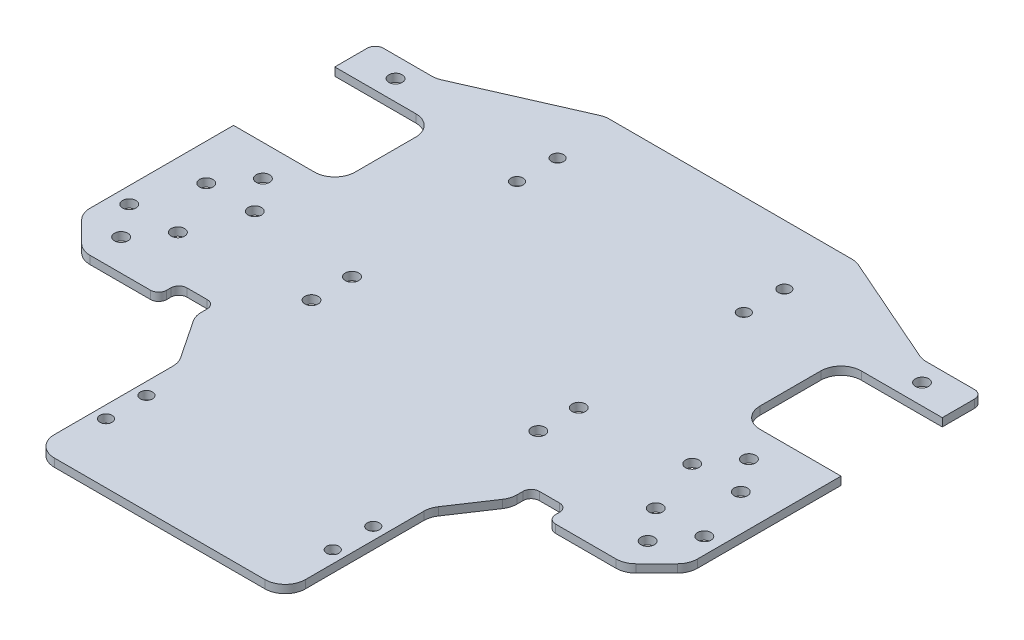
from build123d import *

# Parameters (mm, degrees)
SKETCH_1_W          = 150
SKETCH_1_H          = 141
EXTRUDE_1_DEPTH     = 2
CUT_EXTRUDE_1_REACH = 104.953
SKETCH_2_R          = 1.65
CUT_EXTRUDE_5_REACH = 104.953
SKETCH_9_W          = 44
SKETCH_9_H          = 47.75
CUT_EXTRUDE_2_REACH = 104.953
SKETCH_4_W          = 9
SKETCH_4_H          = 5
CUT_EXTRUDE_6_REACH = 104.953
CHAMFER_1_SIZE      = 8
CUT_EXTRUDE_3_REACH = 104.953
SKETCH_5_R          = 1.65
EXTRUDE_4_DEPTH     = 2
CUT_EXTRUDE_4_REACH = 104.953
SKETCH_8_R          = 1.5
CUT_EXTRUDE_7_REACH = 104.953
SKETCH_11_W         = 25
SKETCH_11_H         = 25
FILLET_5_R          = 5
FILLET_6_R          = 2
CUT_EXTRUDE_8_REACH = 104.953
SKETCH_12_R         = 1.65
FILLET_7_R          = 2


with BuildPart() as part:
    # 草图1 → 凸台-拉伸1 (new body)
    with BuildSketch(Plane(origin=(0, 0, 0), x_dir=(1, 0, 0), z_dir=(0, 1, 0))):
        Rectangle(SKETCH_1_W, SKETCH_1_H)
    extrude(amount=EXTRUDE_1_DEPTH)

    # 草图2 → 切除-拉伸1 (cut, up to next)
    with BuildSketch(Plane(origin=(0, 2, 0), x_dir=(1, 0, 0), z_dir=(0, 1, 0)), mode=Mode.PRIVATE) as cut_extrude_1_sk1:
        with Locations(Location((-60, 15, 0), (0, 0, 270))):
            Circle(SKETCH_2_R)
    cut_extrude_1_tool1 = extrude(cut_extrude_1_sk1.sketch, amount=-CUT_EXTRUDE_1_REACH, mode=Mode.PRIVATE) & part.part
    # 草图2 → 切除-拉伸1 (cut, up to next)
    with BuildSketch(Plane(origin=(0, 2, 0), x_dir=(1, 0, 0), z_dir=(0, 1, 0)), mode=Mode.PRIVATE) as cut_extrude_1_sk2:
        with Locations(Location((-66, 7, 0), (0, 0, 270))):
            Circle(SKETCH_2_R)
    cut_extrude_1_tool2 = extrude(cut_extrude_1_sk2.sketch, amount=-CUT_EXTRUDE_1_REACH, mode=Mode.PRIVATE) & part.part
    # 草图2 → 切除-拉伸1 (cut, up to next)
    with BuildSketch(Plane(origin=(0, 2, 0), x_dir=(1, 0, 0), z_dir=(0, 1, 0)), mode=Mode.PRIVATE) as cut_extrude_1_sk3:
        with Locations(Location((-54, 7, 0), (0, 0, 270))):
            Circle(SKETCH_2_R)
    cut_extrude_1_tool3 = extrude(cut_extrude_1_sk3.sketch, amount=-CUT_EXTRUDE_1_REACH, mode=Mode.PRIVATE) & part.part
    # 草图2 → 切除-拉伸1 (cut, up to next)
    with BuildSketch(Plane(origin=(0, 2, 0), x_dir=(1, 0, 0), z_dir=(0, 1, 0)), mode=Mode.PRIVATE) as cut_extrude_1_sk4:
        with Locations(Location((-71, -7, 0), (0, 0, 270))):
            Circle(SKETCH_2_R)
    cut_extrude_1_tool4 = extrude(cut_extrude_1_sk4.sketch, amount=-CUT_EXTRUDE_1_REACH, mode=Mode.PRIVATE) & part.part
    # 草图2 → 切除-拉伸1 (cut, up to next)
    with BuildSketch(Plane(origin=(0, 2, 0), x_dir=(1, 0, 0), z_dir=(0, 1, 0)), mode=Mode.PRIVATE) as cut_extrude_1_sk5:
        with Locations(Location((-59, -7, 0), (0, 0, 270))):
            Circle(SKETCH_2_R)
    cut_extrude_1_tool5 = extrude(cut_extrude_1_sk5.sketch, amount=-CUT_EXTRUDE_1_REACH, mode=Mode.PRIVATE) & part.part
    # 草图2 → 切除-拉伸1 (cut, up to next)
    with BuildSketch(Plane(origin=(0, 2, 0), x_dir=(1, 0, 0), z_dir=(0, 1, 0)), mode=Mode.PRIVATE) as cut_extrude_1_sk6:
        with Locations(Location((-65, -15, 0), (0, 0, 270))):
            Circle(SKETCH_2_R)
    cut_extrude_1_tool6 = extrude(cut_extrude_1_sk6.sketch, amount=-CUT_EXTRUDE_1_REACH, mode=Mode.PRIVATE) & part.part
    cut_extrude_1_1 = cut_extrude_1_tool1.solids().sort_by_distance((-60, 2, -15))[0]
    add(cut_extrude_1_1, mode=Mode.SUBTRACT)
    cut_extrude_1_2 = cut_extrude_1_tool2.solids().sort_by_distance((-66, 2, -7))[0]
    add(cut_extrude_1_2, mode=Mode.SUBTRACT)
    cut_extrude_1_3 = cut_extrude_1_tool3.solids().sort_by_distance((-54, 2, -7))[0]
    add(cut_extrude_1_3, mode=Mode.SUBTRACT)
    cut_extrude_1_4 = cut_extrude_1_tool4.solids().sort_by_distance((-71, 2, 7))[0]
    add(cut_extrude_1_4, mode=Mode.SUBTRACT)
    cut_extrude_1_5 = cut_extrude_1_tool5.solids().sort_by_distance((-59, 2, 7))[0]
    add(cut_extrude_1_5, mode=Mode.SUBTRACT)
    cut_extrude_1_6 = cut_extrude_1_tool6.solids().sort_by_distance((-65, 2, 15))[0]
    add(cut_extrude_1_6, mode=Mode.SUBTRACT)
    cut_extrude_1 = cut_extrude_1_1 + cut_extrude_1_2 + cut_extrude_1_3 + cut_extrude_1_4 + cut_extrude_1_5 + cut_extrude_1_6  # 切除-拉伸1 as one shape, for the pattern or mirror that repeats it

    # 草图9 → 切除-拉伸5 (cut, up to next)
    with BuildSketch(Plane(origin=(0, 2, 0), x_dir=(1, 0, 0), z_dir=(0, 1, 0)), mode=Mode.PRIVATE) as cut_extrude_5_sk1:
        with Locations((-53, -46.625)):
            Rectangle(SKETCH_9_W, SKETCH_9_H)
    cut_extrude_5_tool1 = extrude(cut_extrude_5_sk1.sketch, amount=-CUT_EXTRUDE_5_REACH, mode=Mode.PRIVATE) & part.part
    # 草图9 → 切除-拉伸5 (cut, up to next)
    with BuildSketch(Plane(origin=(0, 2, 0), x_dir=(1, 0, 0), z_dir=(0, 1, 0)), mode=Mode.PRIVATE) as cut_extrude_5_sk2:
        with Locations((53, -46.625)):
            Rectangle(SKETCH_9_W, SKETCH_9_H)
    cut_extrude_5_tool2 = extrude(cut_extrude_5_sk2.sketch, amount=-CUT_EXTRUDE_5_REACH, mode=Mode.PRIVATE) & part.part
    add(cut_extrude_5_tool1.solids().sort_by_distance((-53, 2, 46.625))[0], mode=Mode.SUBTRACT)
    add(cut_extrude_5_tool2.solids().sort_by_distance((53, 2, 46.625))[0], mode=Mode.SUBTRACT)

    # 草图4 → 切除-拉伸2 (cut, up to next)
    with BuildSketch(Plane(origin=(0, 2, 0), x_dir=(1, 0, 0), z_dir=(0, 1, 0)), mode=Mode.PRIVATE) as cut_extrude_2_sk1:
        with Locations((-43.5, -20.25)):
            Rectangle(SKETCH_4_W, SKETCH_4_H)
    cut_extrude_2_tool1 = extrude(cut_extrude_2_sk1.sketch, amount=-CUT_EXTRUDE_2_REACH, mode=Mode.PRIVATE) & part.part
    cut_extrude_2 = cut_extrude_2_tool1.solids().sort_by_distance((-43.5, 2, 20.25))[0]
    add(cut_extrude_2, mode=Mode.SUBTRACT)

    # 草图10 → 切除-拉伸6 (cut, up to next)
    with BuildSketch(Plane(origin=(0, 2, 0), x_dir=(1, 0, 0), z_dir=(0, 1, 0)), mode=Mode.PRIVATE) as cut_extrude_6_sk1:
        Polygon((-75, 70.5), (-31, 70.5), (-60, 57.75), (-75, 57.75), align=None)
    cut_extrude_6_tool1 = extrude(cut_extrude_6_sk1.sketch, amount=-CUT_EXTRUDE_6_REACH, mode=Mode.PRIVATE) & part.part
    cut_extrude_6 = cut_extrude_6_tool1.solids().sort_by_distance((-59.062147, 2, -65.169492))[0]
    add(cut_extrude_6, mode=Mode.SUBTRACT)

    # 镜向1: 切除-拉伸1, 切除-拉伸2, 切除-拉伸6 across plane
    add(cut_extrude_1.mirror(Plane(origin=(0, 0, 0), x_dir=(0, 0, 1), z_dir=(1, 0, 0))), mode=Mode.SUBTRACT)
    add(cut_extrude_2.mirror(Plane(origin=(0, 0, 0), x_dir=(0, 0, 1), z_dir=(1, 0, 0))), mode=Mode.SUBTRACT)
    add(cut_extrude_6.mirror(Plane(origin=(0, 0, 0), x_dir=(0, 0, 1), z_dir=(1, 0, 0))), mode=Mode.SUBTRACT)

    # 倒角1
    chamfer_1_edges = [part.edges().sort_by_distance(p)[0] for p in [
        (-75, 1, 22.75),
        (75, 1, 22.75),
    ]]
    chamfer(chamfer_1_edges, length=CHAMFER_1_SIZE)

    # 草图5 → 切除-拉伸3 (cut, up to next)
    with BuildSketch(Plane(origin=(0, 2, 0), x_dir=(1, 0, 0), z_dir=(0, 1, 0)), mode=Mode.PRIVATE) as cut_extrude_3_sk1:
        with Locations(Location((-28, 5, 0), (0, 0, 270))):
            Circle(SKETCH_5_R)
    cut_extrude_3_tool1 = extrude(cut_extrude_3_sk1.sketch, amount=-CUT_EXTRUDE_3_REACH, mode=Mode.PRIVATE) & part.part
    # 草图5 → 切除-拉伸3 (cut, up to next)
    with BuildSketch(Plane(origin=(0, 2, 0), x_dir=(1, 0, 0), z_dir=(0, 1, 0)), mode=Mode.PRIVATE) as cut_extrude_3_sk2:
        with Locations(Location((-28, -5, 0), (0, 0, 270))):
            Circle(SKETCH_5_R)
    cut_extrude_3_tool2 = extrude(cut_extrude_3_sk2.sketch, amount=-CUT_EXTRUDE_3_REACH, mode=Mode.PRIVATE) & part.part
    # 草图5 → 切除-拉伸3 (cut, up to next)
    with BuildSketch(Plane(origin=(0, 2, 0), x_dir=(1, 0, 0), z_dir=(0, 1, 0)), mode=Mode.PRIVATE) as cut_extrude_3_sk3:
        with Locations(Location((28, -5, 0), (0, 0, 270))):
            Circle(SKETCH_5_R)
    cut_extrude_3_tool3 = extrude(cut_extrude_3_sk3.sketch, amount=-CUT_EXTRUDE_3_REACH, mode=Mode.PRIVATE) & part.part
    # 草图5 → 切除-拉伸3 (cut, up to next)
    with BuildSketch(Plane(origin=(0, 2, 0), x_dir=(1, 0, 0), z_dir=(0, 1, 0)), mode=Mode.PRIVATE) as cut_extrude_3_sk4:
        with Locations(Location((28, 5, 0), (0, 0, 270))):
            Circle(SKETCH_5_R)
    cut_extrude_3_tool4 = extrude(cut_extrude_3_sk4.sketch, amount=-CUT_EXTRUDE_3_REACH, mode=Mode.PRIVATE) & part.part
    add(cut_extrude_3_tool1.solids().sort_by_distance((-28, 2, -5))[0], mode=Mode.SUBTRACT)
    add(cut_extrude_3_tool2.solids().sort_by_distance((-28, 2, 5))[0], mode=Mode.SUBTRACT)
    add(cut_extrude_3_tool3.solids().sort_by_distance((28, 2, 5))[0], mode=Mode.SUBTRACT)
    add(cut_extrude_3_tool4.solids().sort_by_distance((28, 2, -5))[0], mode=Mode.SUBTRACT)

    # 草图7 → 凸台-拉伸4 (add)
    with BuildSketch(Plane(origin=(0, 0, 0), x_dir=(1, 0, 0), z_dir=(0, 1, 0))):
        Polygon((-39, -22.75), (-31, -34.75), (-31, -22.75), align=None)
        Polygon((31, -22.75), (39, -22.75), (31, -34.75), align=None)
    extrude(amount=EXTRUDE_4_DEPTH)

    # 草图8 → 切除-拉伸4 (cut, up to next)
    with BuildSketch(Plane(origin=(0, 2, 0), x_dir=(1, 0, 0), z_dir=(0, 1, 0)), mode=Mode.PRIVATE) as cut_extrude_4_sk1:
        with Locations(Location((-28, -45.75, 0), (0, 0, 270))):
            Circle(SKETCH_8_R)
    cut_extrude_4_tool1 = extrude(cut_extrude_4_sk1.sketch, amount=-CUT_EXTRUDE_4_REACH, mode=Mode.PRIVATE) & part.part
    # 草图8 → 切除-拉伸4 (cut, up to next)
    with BuildSketch(Plane(origin=(0, 2, 0), x_dir=(1, 0, 0), z_dir=(0, 1, 0)), mode=Mode.PRIVATE) as cut_extrude_4_sk2:
        with Locations(Location((-28, -55.75, 0), (0, 0, 270))):
            Circle(SKETCH_8_R)
    cut_extrude_4_tool2 = extrude(cut_extrude_4_sk2.sketch, amount=-CUT_EXTRUDE_4_REACH, mode=Mode.PRIVATE) & part.part
    # 草图8 → 切除-拉伸4 (cut, up to next)
    with BuildSketch(Plane(origin=(0, 2, 0), x_dir=(1, 0, 0), z_dir=(0, 1, 0)), mode=Mode.PRIVATE) as cut_extrude_4_sk3:
        with Locations(Location((28, -45.75, 0), (0, 0, 270))):
            Circle(SKETCH_8_R)
    cut_extrude_4_tool3 = extrude(cut_extrude_4_sk3.sketch, amount=-CUT_EXTRUDE_4_REACH, mode=Mode.PRIVATE) & part.part
    # 草图8 → 切除-拉伸4 (cut, up to next)
    with BuildSketch(Plane(origin=(0, 2, 0), x_dir=(1, 0, 0), z_dir=(0, 1, 0)), mode=Mode.PRIVATE) as cut_extrude_4_sk4:
        with Locations(Location((28, -55.75, 0), (0, 0, 270))):
            Circle(SKETCH_8_R)
    cut_extrude_4_tool4 = extrude(cut_extrude_4_sk4.sketch, amount=-CUT_EXTRUDE_4_REACH, mode=Mode.PRIVATE) & part.part
    cut_extrude_4_1 = cut_extrude_4_tool1.solids().sort_by_distance((-28, 2, 45.75))[0]
    add(cut_extrude_4_1, mode=Mode.SUBTRACT)
    cut_extrude_4_2 = cut_extrude_4_tool2.solids().sort_by_distance((-28, 2, 55.75))[0]
    add(cut_extrude_4_2, mode=Mode.SUBTRACT)
    cut_extrude_4_3 = cut_extrude_4_tool3.solids().sort_by_distance((28, 2, 45.75))[0]
    add(cut_extrude_4_3, mode=Mode.SUBTRACT)
    cut_extrude_4_4 = cut_extrude_4_tool4.solids().sort_by_distance((28, 2, 55.75))[0]
    add(cut_extrude_4_4, mode=Mode.SUBTRACT)
    cut_extrude_4 = cut_extrude_4_1 + cut_extrude_4_2 + cut_extrude_4_3 + cut_extrude_4_4  # 切除-拉伸4 as one shape, for the pattern or mirror that repeats it

    # 草图11 → 切除-拉伸7 (cut, up to next)
    with BuildSketch(Plane(origin=(0, 2, 0), x_dir=(1, 0, 0), z_dir=(0, 1, 0)), mode=Mode.PRIVATE) as cut_extrude_7_sk1:
        with Locations((-62.5, 35.25)):
            Rectangle(SKETCH_11_W, SKETCH_11_H)
    cut_extrude_7_tool1 = extrude(cut_extrude_7_sk1.sketch, amount=-CUT_EXTRUDE_7_REACH, mode=Mode.PRIVATE) & part.part
    # 草图11 → 切除-拉伸7 (cut, up to next)
    with BuildSketch(Plane(origin=(0, 2, 0), x_dir=(1, 0, 0), z_dir=(0, 1, 0)), mode=Mode.PRIVATE) as cut_extrude_7_sk2:
        with Locations((62.5, 35.25)):
            Rectangle(SKETCH_11_W, SKETCH_11_H)
    cut_extrude_7_tool2 = extrude(cut_extrude_7_sk2.sketch, amount=-CUT_EXTRUDE_7_REACH, mode=Mode.PRIVATE) & part.part
    add(cut_extrude_7_tool1.solids().sort_by_distance((-62.5, 2, -35.25))[0], mode=Mode.SUBTRACT)
    add(cut_extrude_7_tool2.solids().sort_by_distance((62.5, 2, -35.25))[0], mode=Mode.SUBTRACT)

    # 镜向2: 切除-拉伸4 across plane
    add(cut_extrude_4.mirror(Plane.XY), mode=Mode.SUBTRACT)

    # 圆角5
    fillet_5_edges = [part.edges().sort_by_distance(p)[0] for p in [
        (39, 1, 22.75),
        (60, 1, -57.75),
        (31, 1, -70.5),
        (67, 1, 22.75),
        (75, 1, 14.75),
        (-75, 1, 14.75),
        (-67, 1, 22.75),
        (-31, 1, 34.75),
        (31, 1, 34.75),
        (-50, 1, -47.75),
        (-50, 1, -22.75),
        (50, 1, -22.75),
        (50, 1, -47.75),
        (-31, 1, 70.5),
        (31, 1, 70.5),
        (-39, 1, 22.75),
        (-31, 1, -70.5),
        (-60, 1, -57.75),
    ]]
    fillet(fillet_5_edges, radius=FILLET_5_R)

    # 圆角6
    fillet_6_edges = [part.edges().sort_by_distance(p)[0] for p in [
        (48, 1, 17.75),
        (48, 1, 22.75),
        (39, 1, 17.75),
        (-48, 1, 22.75),
        (-48, 1, 17.75),
        (-39, 1, 17.75),
    ]]
    fillet(fillet_6_edges, radius=FILLET_6_R)

    # 草图12 → 切除-拉伸8 (cut, up to next)
    with BuildSketch(Plane(origin=(0, 2, 0), x_dir=(1, 0, 0), z_dir=(0, 1, 0)), mode=Mode.PRIVATE) as cut_extrude_8_sk1:
        with Locations(Location((-65, 52.75, 0), (0, 0, 270))):
            Circle(SKETCH_12_R)
    cut_extrude_8_tool1 = extrude(cut_extrude_8_sk1.sketch, amount=-CUT_EXTRUDE_8_REACH, mode=Mode.PRIVATE) & part.part
    # 草图12 → 切除-拉伸8 (cut, up to next)
    with BuildSketch(Plane(origin=(0, 2, 0), x_dir=(1, 0, 0), z_dir=(0, 1, 0)), mode=Mode.PRIVATE) as cut_extrude_8_sk2:
        with Locations(Location((65, 52.75, 0), (0, 0, 90))):
            Circle(SKETCH_12_R)
    cut_extrude_8_tool2 = extrude(cut_extrude_8_sk2.sketch, amount=-CUT_EXTRUDE_8_REACH, mode=Mode.PRIVATE) & part.part
    add(cut_extrude_8_tool1.solids().sort_by_distance((-65, 2, -52.75))[0], mode=Mode.SUBTRACT)
    add(cut_extrude_8_tool2.solids().sort_by_distance((65, 2, -52.75))[0], mode=Mode.SUBTRACT)

    # 圆角7
    fillet_7_edges = [part.edges().sort_by_distance(p)[0] for p in [
        (75, 1, -57.75),
        (-75, 1, -57.75),
    ]]
    fillet(fillet_7_edges, radius=FILLET_7_R)


solid = part.part
